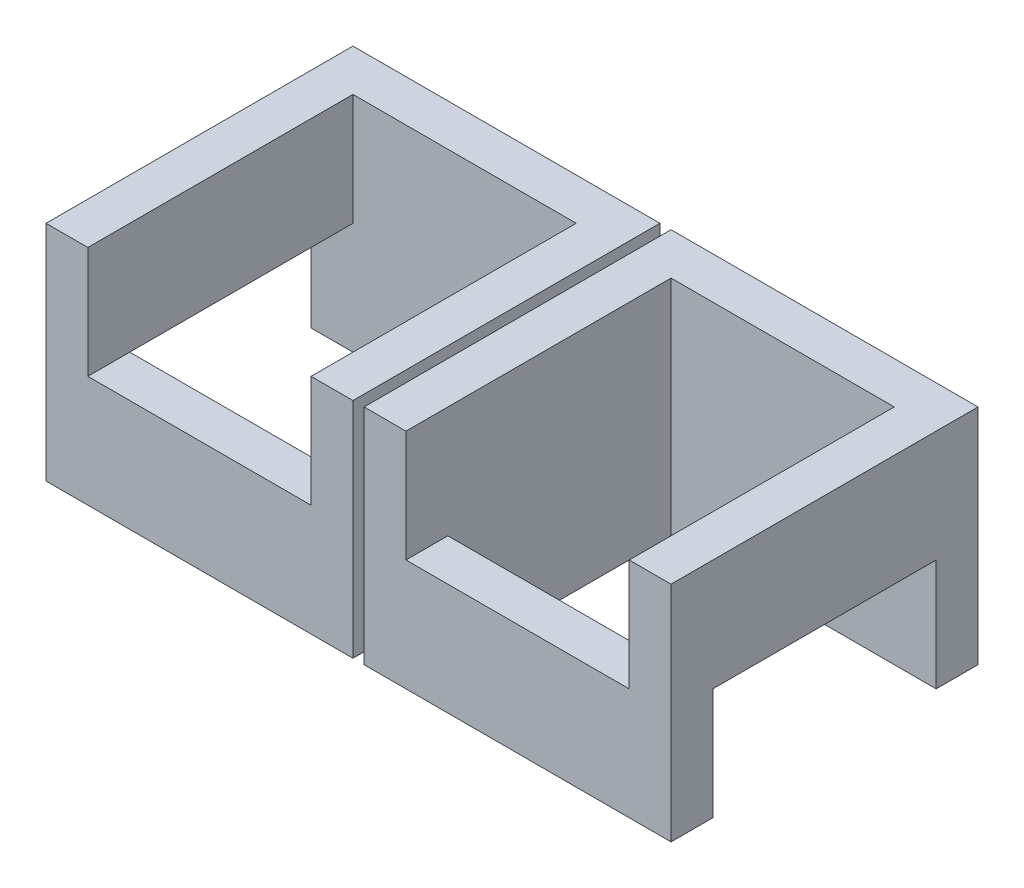
from build123d import *

# Parameters (mm, degrees)
SKETCH1_W           = 139.7
SKETCH1_H           = 139.7
SKETCH1_W_2         = 101.6
SKETCH1_H_2         = 101.6
EXTRUDE_THIN1_DEPTH = 101.6
CUT_EXTRUDE1_START  = -50.8
SKETCH2_W           = 101.6
SKETCH2_H           = 19.05
CUT_EXTRUDE1_DEPTH  = 50.8
CUT_EXTRUDE2_START  = -50.8
SKETCH3_W           = 19.05
SKETCH3_H           = 101.6
CUT_EXTRUDE2_DEPTH  = 50.8


with BuildPart() as part:
    # Sketch1 → Extrude-Thin1 (new body)
    with BuildSketch(Plane(origin=(0, 0, 0), x_dir=(1, 0, 0), z_dir=(0, 1, 0))):
        Rectangle(SKETCH1_W, SKETCH1_H)
        Rectangle(SKETCH1_W_2, SKETCH1_H_2, mode=Mode.SUBTRACT)
    extrude(amount=EXTRUDE_THIN1_DEPTH)

    # Sketch2 → Cut-Extrude1 (cut)
    with BuildSketch(Plane(origin=(0, 101.6, 0), x_dir=(1, 0, 0), z_dir=(0, 1, 0)).offset(CUT_EXTRUDE1_START)):
        with Locations((0, -60.325)):
            Rectangle(SKETCH2_W, SKETCH2_H)
    extrude(amount=CUT_EXTRUDE1_DEPTH, mode=Mode.SUBTRACT)

    # Sketch3 → Cut-Extrude2 (cut)
    with BuildSketch(Plane.XZ.offset(CUT_EXTRUDE2_START)):
        with Locations((-60.325, 0)):
            Rectangle(SKETCH3_W, SKETCH3_H)
    extrude(amount=CUT_EXTRUDE2_DEPTH, mode=Mode.SUBTRACT)


with BuildPart() as body_2:
    # Mirror2: mirrored copy
    add(part.part.mirror(Plane(origin=(72.39, 0, 0), x_dir=(0, 0, 1), z_dir=(1, 0, 0))))


solid = Compound([part.part, body_2.part])
